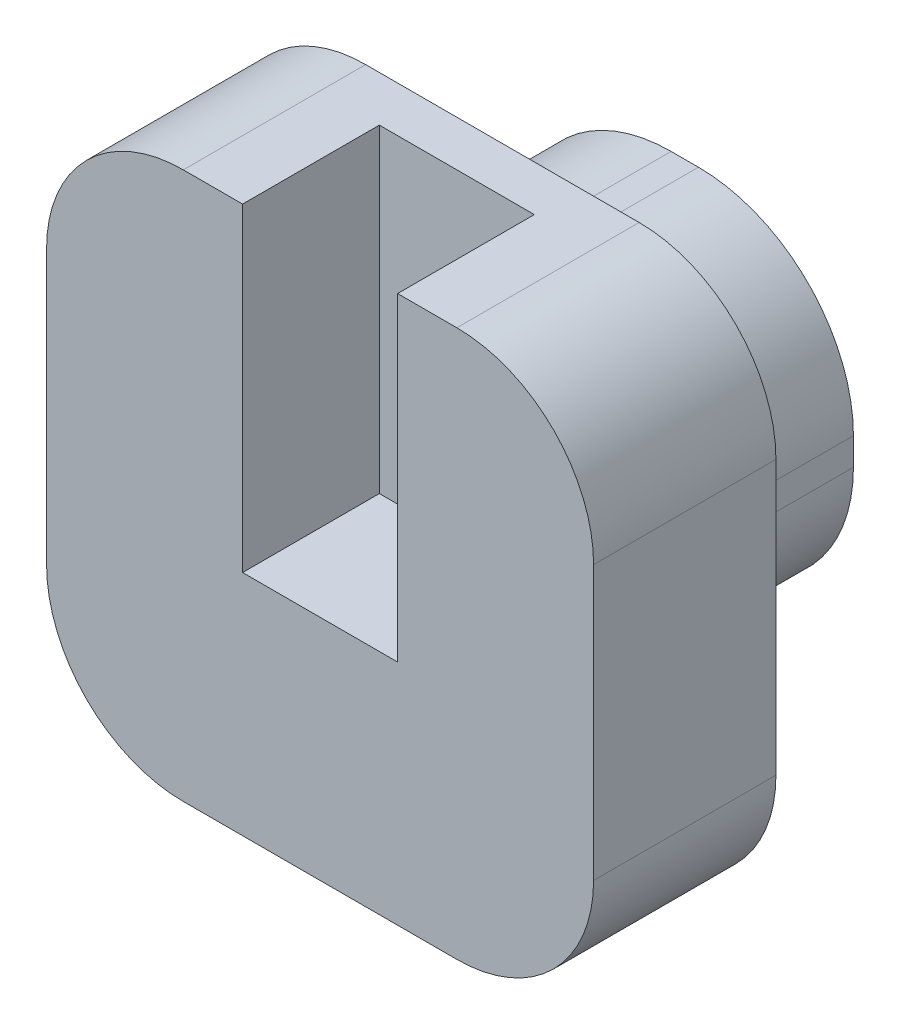
from build123d import *

# Parameters (mm, degrees)
EXTRUDE_1_DEPTH     = 2
EXTRUDE_2_DEPTH     = 2
SKETCH_4_W          = 1.7
SKETCH_4_H          = 1.5
CUT_EXTRUDE_1_DEPTH = 3.5


with BuildPart() as part:
    # Эскиз1 → Бобышка-Вытянуть1 (new body)
    with BuildSketch(Plane.XY):
        with BuildLine():
            Line((-0.15, -1.85), (0.15, -1.85))
            ThreePointArc((0.15, -1.85), (1.352081528, -1.352081528), (1.85, -0.15))
            Line((1.85, -0.15), (1.85, 0.15))
            ThreePointArc((1.85, 0.15), (1.352081528, 1.352081528), (0.15, 1.85))
            Line((0.15, 1.85), (-0.15, 1.85))
            ThreePointArc((-0.15, 1.85), (-1.352081528, 1.352081528), (-1.85, 0.15))
            Line((-1.85, 0.15), (-1.85, -0.15))
            ThreePointArc((-1.85, -0.15), (-1.352081528, -1.352081528), (-0.15, -1.85))
        make_face()
    extrude(amount=EXTRUDE_1_DEPTH)

    # Эскиз2 → Бобышка-Вытянуть2 (add)
    with BuildSketch(Plane.XY.offset(2)):
        with BuildLine():
            Line((-1.5, -3), (1.5, -3))
            ThreePointArc((1.5, -3), (2.560660172, -2.560660172), (3, -1.5))
            Line((3, -1.5), (3, 1.5))
            ThreePointArc((3, 1.5), (2.560660172, 2.560660172), (1.5, 3))
            Line((1.5, 3), (-1.5, 3))
            ThreePointArc((-1.5, 3), (-2.560660172, 2.560660172), (-3, 1.5))
            Line((-3, 1.5), (-3, -1.5))
            ThreePointArc((-3, -1.5), (-2.560660172, -2.560660172), (-1.5, -3))
        make_face()
    extrude(amount=EXTRUDE_2_DEPTH)

    # Эскиз4 → Вырез-Вытянуть1 (cut)
    with BuildSketch(Plane(origin=(0, 3, 0), x_dir=(1, 0, 0), z_dir=(0, 1, 0))):
        with Locations((0, -3.25)):
            Rectangle(SKETCH_4_W, SKETCH_4_H)
    extrude(amount=-CUT_EXTRUDE_1_DEPTH, mode=Mode.SUBTRACT)


solid = part.part
